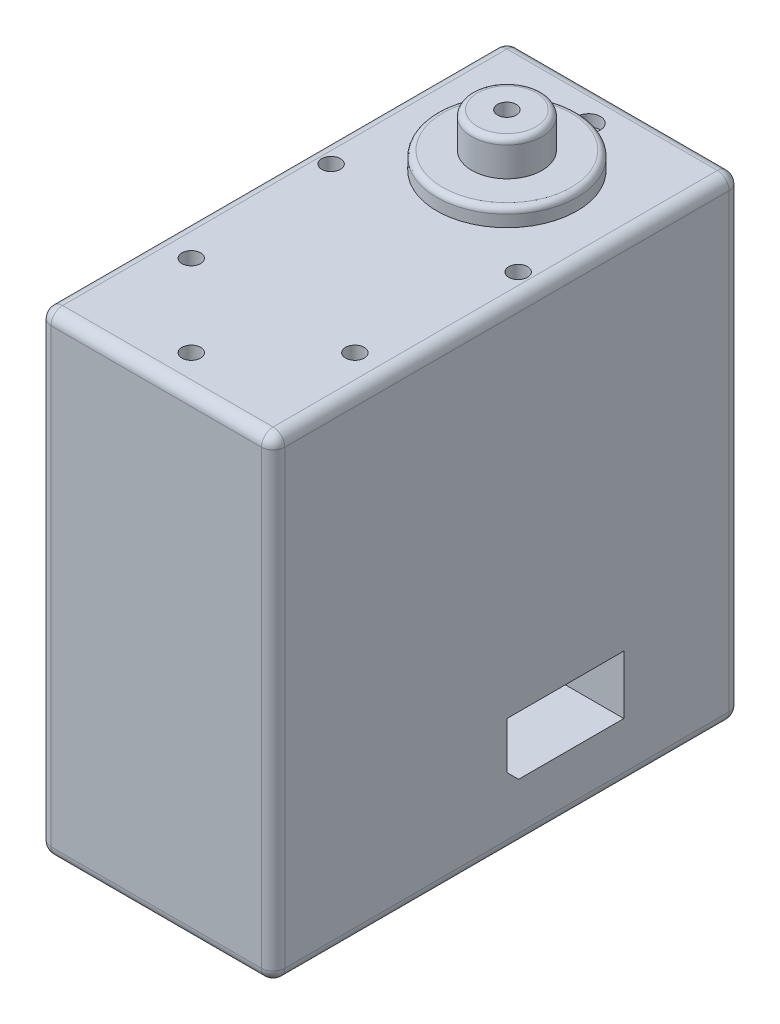
from build123d import *

# Parameters (mm, degrees)
SKETCH_1_W                 = 40
SKETCH_1_H                 = 40.6
EXTRUDE_1_DEPTH            = 10
SKETCH_2_R                 = 6
EXTRUDE_2_DEPTH            = 1.5
SKETCH_3_R                 = 3
EXTRUDE_3_DEPTH            = 3
PATTERN_LINEAR_1_COUNT     = 2
PATTERN_LINEAR_1_PITCH     = 20
PATTERN_LINEAR_2_COUNT     = 2
PATTERN_LINEAR_2_PITCH     = 35
HOLE_WIZARD_M2_2_D         = 1.6
HOLE_WIZARD_M2_2_DEPTH     = 5.2
HOLE_WIZARD_M2_2_TIP       = 0.480688495
FILLET_1_R                 = 1
FILLET_3_R                 = 0.5
FILLET_4_R                 = 0.5
HOLE_WIZARD_M2_3_D         = 1.6
HOLE_WIZARD_M2_3_DEPTH     = 5.2
HOLE_WIZARD_M2_3_TIP       = 0.480688495
SKETCH_12_R                = 1
CUT_EXTRUDE_2_DEPTH        = 1
SKETCH_13_W                = 10
SKETCH_13_H                = 5
CUT_EXTRUDE_3_DEPTH        = 5
CHAMFER_1_SIZE             = 1
CHAMFER_1_OF_MIRROR_3_SIZE = 1


with BuildPart() as part:
    # 草图1 → 凸台-拉伸1 (new, symmetric)
    with BuildSketch(Plane(origin=(0, 0, 0), x_dir=(0, 0, -1), z_dir=(1, 0, 0))):
        Rectangle(SKETCH_1_W, SKETCH_1_H)
    extrude(amount=EXTRUDE_1_DEPTH, both=True)

    # 草图2 → 凸台-拉伸2 (add)
    with BuildSketch(Plane(origin=(0, 20.3, 0), x_dir=(1, 0, 0), z_dir=(0, 1, 0))):
        with Locations(Location((0, 10, 0), (0, 0, 90))):
            Circle(SKETCH_2_R)
    extrude_2 = extrude(amount=EXTRUDE_2_DEPTH)

    # 草图3 → 凸台-拉伸3 (add)
    with BuildSketch(Plane(origin=(0, 21.8, 0), x_dir=(1, 0, 0), z_dir=(0, 1, 0))):
        with Locations(Location((0, 10, 0), (0, 0, 270))):
            Circle(SKETCH_3_R)
    extrude_3 = extrude(amount=EXTRUDE_3_DEPTH)

    # 镜向1: 凸台-拉伸2, 凸台-拉伸3 across plane
    add(extrude_2.mirror(Plane.ZX))
    add(extrude_3.mirror(Plane.ZX))

    # 草图7 → M2 螺纹孔1 (revolve, cut)
    with BuildSketch(Plane(origin=(7.5, -20.3, -17.5), x_dir=(0, 0, -1), z_dir=(1, 0, 0))):
        Polygon((0, 0), (0, 5.680688495), (0.8, 5.2), (0.8, 0), align=None)
    hole_wizard_m2_1 = revolve(axis=Axis((7.5, -26.65, -17.5), (0, 1, 0)), mode=Mode.SUBTRACT)

    # 阵列(线性)1: M2 螺纹孔1 ×2
    with Locations(*[(0, 0, i * PATTERN_LINEAR_1_PITCH) for i in range(1, PATTERN_LINEAR_1_COUNT)]):
        add(hole_wizard_m2_1, mode=Mode.SUBTRACT)

    # 阵列(线性)2: M2 螺纹孔1 ×2
    with Locations(*[(0, 0, i * PATTERN_LINEAR_2_PITCH) for i in range(1, PATTERN_LINEAR_2_COUNT)]):
        add(hole_wizard_m2_1, mode=Mode.SUBTRACT)

    # 镜向2: M2 螺纹孔1 across plane
    add(hole_wizard_m2_1.mirror(Plane(origin=(0, 0, 0), x_dir=(0, 0, 1), z_dir=(1, 0, 0))), mode=Mode.SUBTRACT)

    # 镜向2 copy 1 sketch → 镜向2 copy 1 (revolve, cut)
    with BuildSketch(Plane(origin=(-7.5, -20.3, 2.5), x_dir=(0, 0, -1), z_dir=(-1, 0, 0))):
        Polygon((0, 0), (0, -5.680688495), (0.8, -5.2), (0.8, 0), align=None)
    revolve(axis=Axis((-7.5, -26.65, 2.5), (0, -1, 0)), mode=Mode.SUBTRACT)

    # 镜向2 copy 2 sketch → 镜向2 copy 2 (revolve, cut)
    with BuildSketch(Plane(origin=(-7.5, -20.3, 17.5), x_dir=(0, 0, -1), z_dir=(-1, 0, 0))):
        Polygon((0, 0), (0, -5.680688495), (0.8, -5.2), (0.8, 0), align=None)
    revolve(axis=Axis((-7.5, -26.65, 17.5), (0, -1, 0)), mode=Mode.SUBTRACT)

    # M2 螺纹孔2
    with Locations(Plane(origin=(0, 20.3, 17), x_dir=(0, 0, 1), z_dir=(0, 1, 0))):
        with Locations((0, 0), (-7, -7), (-7, 7), (-19.961481397, -8), (-19.961481397, 8)):
            Hole(HOLE_WIZARD_M2_2_D / 2, depth=HOLE_WIZARD_M2_2_DEPTH)
            with Locations((0, 0, -(HOLE_WIZARD_M2_2_DEPTH + HOLE_WIZARD_M2_2_TIP / 2))):  # 118° drill point
                Cone(0, HOLE_WIZARD_M2_2_D / 2, HOLE_WIZARD_M2_2_TIP, mode=Mode.SUBTRACT)

    # 圆角1
    fillet_1_edges = [part.edges().sort_by_distance(p)[0] for p in [
        (10, 0, -20),
        (10, 20.3, 0),
        (10, 0, 20),
        (-10, 20.3, 0),
        (-10, 0, -20),
        (-10, -20.3, 0),
        (-10, 0, 20),
        (10, -20.3, 0),
        (0, 20.3, 20),
        (0, 20.3, -20),
        (0, -20.3, -20),
        (0, -20.3, 20),
    ]]
    fillet(fillet_1_edges, radius=FILLET_1_R)

    # 圆角3
    fillet_3_edges = [part.edges().sort_by_distance(p)[0] for p in [
        (0, 21.8, -4),
    ]]
    fillet(fillet_3_edges, radius=FILLET_3_R)

    # 圆角4
    fillet_4_edges = [part.edges().sort_by_distance(p)[0] for p in [
        (0, 24.8, -13),
        (0, -24.8, -13),
    ]]
    fillet(fillet_4_edges, radius=FILLET_4_R)

    # M2 螺纹孔3
    with Locations(Plane(origin=(0, 24.8, -10), x_dir=(0, 0, 1), z_dir=(0, 1, 0))):
        with Locations((0, 0)):
            Hole(HOLE_WIZARD_M2_3_D / 2, depth=HOLE_WIZARD_M2_3_DEPTH)
            with Locations((0, 0, -(HOLE_WIZARD_M2_3_DEPTH + HOLE_WIZARD_M2_3_TIP / 2))):  # 118° drill point
                Cone(0, HOLE_WIZARD_M2_3_D / 2, HOLE_WIZARD_M2_3_TIP, mode=Mode.SUBTRACT)

    # 草图12 → 切除-拉伸2 (cut)
    with BuildSketch(Plane(origin=(0, 20.3, 0), x_dir=(1, 0, 0), z_dir=(0, 1, 0))):
        with Locations(Location((0, 17, 0), (0, 0, 270))):
            Circle(SKETCH_12_R)
    extrude(amount=-CUT_EXTRUDE_2_DEPTH, mode=Mode.SUBTRACT)

    # 草图13 → 切除-拉伸3 (cut)
    with BuildSketch(Plane.ZY.offset(10)):
        with Locations((-5, -12.8)):
            Rectangle(SKETCH_13_W, SKETCH_13_H)
    cut_extrude_3 = extrude(amount=-CUT_EXTRUDE_3_DEPTH, mode=Mode.SUBTRACT)

    # 倒角1
    chamfer_1_edges = [part.edges().sort_by_distance(p)[0] for p in [
        (-7.5, -15.3, 0),
    ]]
    chamfer(chamfer_1_edges, length=CHAMFER_1_SIZE)

    # 镜向3: 切除-拉伸3 across plane
    add(cut_extrude_3.mirror(Plane(origin=(0, 0, 0), x_dir=(0, 0, 1), z_dir=(1, 0, 0))), mode=Mode.SUBTRACT)

    # 倒角1 of 镜向3
    chamfer_1_of_mirror_3_edges = [part.edges().sort_by_distance(p)[0] for p in [
        (7.5, -15.3, 0),
    ]]
    chamfer(chamfer_1_of_mirror_3_edges, length=CHAMFER_1_OF_MIRROR_3_SIZE)


solid = part.part
